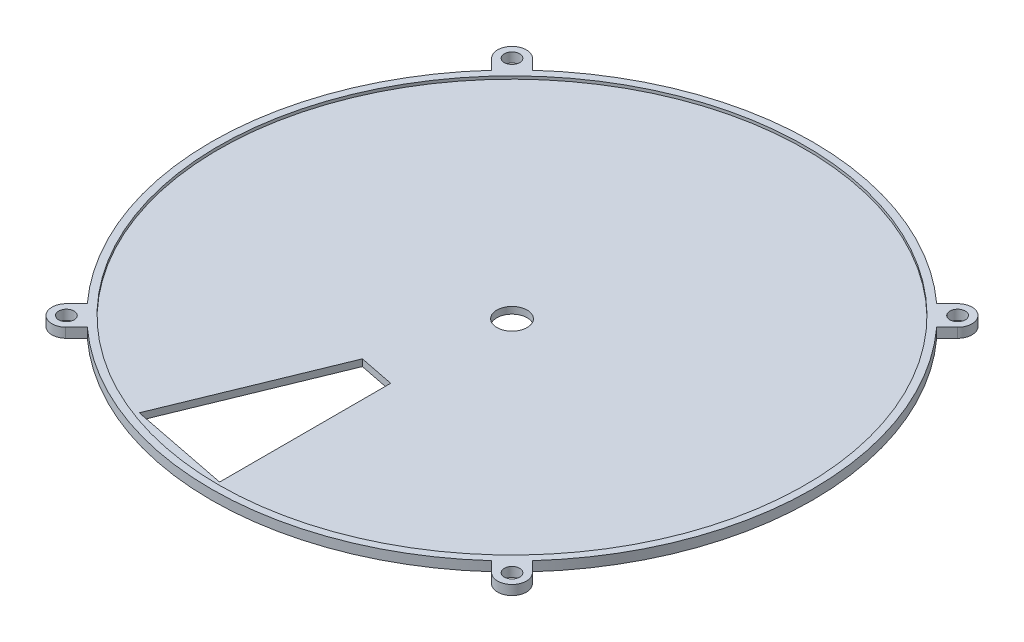
from build123d import *

# Parameters (mm, degrees)
SKETCH_1_R               = 1.6
EXTRUDE_1_DEPTH          = 2
SKETCH_2_R               = 61
CUT_EXTRUDE_3_DEPTH      = 0.6
SKETCH_3_R               = 3.15
CUT_EXTRUDE_4_DEPTH      = 2
CUT_EXTRUDE_6_DEPTH      = 56
CUT_EXTRUDE_6_DEPTH_BACK = 58


with BuildPart() as part:
    # Эскиз1 → Бобышка-Вытянуть1 (new body)
    with BuildSketch(Plane(origin=(0, 0, 0), x_dir=(1, 0, 0), z_dir=(0, 1, 0))):
        with BuildLine():
            ThreePointArc((-44.194173824, 48.436814511), (-48.387717364, 48.484800745), (-48.531650935, 44.293453322))
            Line((-48.531650935, 44.293453322), (-48.337535014, 44.0993374))
            Line((-48.337535014, 44.0993374), (-46.262438284, 42.024240671))
            ThreePointArc((-46.262438284, 42.024240671), (-62.49999998, 0.001572675), (-46.264553121, -42.021912433))
            Line((-46.264553121, -42.021912433), (-48.436814511, -44.194173824))
            ThreePointArc((-48.436814511, -44.194173824), (-48.484800745, -48.387717364), (-44.293453322, -48.531650935))
            Line((-44.293453322, -48.531650935), (-44.0993374, -48.337535014))
            Line((-44.0993374, -48.337535014), (-42.024240671, -46.262438284))
            ThreePointArc((-42.024240671, -46.262438284), (-0.001572675, -62.49999998), (42.021912433, -46.264553121))
            Line((42.021912433, -46.264553121), (44.194173824, -48.436814511))
            ThreePointArc((44.194173824, -48.436814511), (48.387717364, -48.484800745), (48.531650935, -44.293453322))
            Line((48.531650935, -44.293453322), (48.337535014, -44.0993374))
            Line((48.337535014, -44.0993374), (46.262438284, -42.024240671))
            ThreePointArc((46.262438284, -42.024240671), (62.49999998, -0.001572675), (46.264553121, 42.021912433))
            Line((46.264553121, 42.021912433), (48.436814511, 44.194173824))
            ThreePointArc((48.436814511, 44.194173824), (48.484800745, 48.387717364), (44.293453322, 48.531650935))
            Line((44.293453322, 48.531650935), (44.0993374, 48.337535014))
            Line((44.0993374, 48.337535014), (42.024240671, 46.262438284))
            ThreePointArc((42.024240671, 46.262438284), (0.001572675, 62.49999998), (-42.021912433, 46.264553121))
            Line((-42.021912433, 46.264553121), (-44.194173824, 48.436814511))
        make_face()
        with Locations(Location((-46.315494168, -46.315494168, 0), (0, 0, 270))):
            Circle(SKETCH_1_R, mode=Mode.SUBTRACT)
        with Locations(Location((46.315494168, -46.315494168, 0), (0, 0, 270))):
            Circle(SKETCH_1_R, mode=Mode.SUBTRACT)
        with Locations(Location((-46.315494168, 46.315494168, 0), (0, 0, 270))):
            Circle(SKETCH_1_R, mode=Mode.SUBTRACT)
        with Locations(Location((46.315494168, 46.315494168, 0), (0, 0, 270))):
            Circle(SKETCH_1_R, mode=Mode.SUBTRACT)
    extrude(amount=EXTRUDE_1_DEPTH)

    # Эскиз2 → Вырез-Вытянуть3 (cut)
    with BuildSketch(Plane(origin=(0, 2, 0), x_dir=(1, 0, 0), z_dir=(0, 1, 0))):
        with Locations(Location((0, 0, 0), (0, 0, 270))):
            Circle(SKETCH_2_R)
    extrude(amount=-CUT_EXTRUDE_3_DEPTH, mode=Mode.SUBTRACT)

    # Эскиз3 → Вырез-Вытянуть4 (cut)
    with BuildSketch(Plane(origin=(0, 1.4, 0), x_dir=(1, 0, 0), z_dir=(0, 1, 0))):
        with Locations(Location((0, 0, 0), (0, 0, 270))):
            Circle(SKETCH_3_R)
    extrude(amount=-CUT_EXTRUDE_4_DEPTH, mode=Mode.SUBTRACT)

    # Эскиз6 → Вырез-Вытянуть6 (cut, two sides: drawn at the far end of the back side and taken through both)
    with BuildSketch(Plane(origin=(0, 0, 0), x_dir=(1, 0, 0), z_dir=(0, 1, 0)).offset(-CUT_EXTRUDE_6_DEPTH_BACK)):
        Polygon((-21.818311129, -55.668605856), (-8.341675093, -22.760328818), (-1, -24.220678791), (-1, -59.783022844), align=None)
    extrude(amount=CUT_EXTRUDE_6_DEPTH + CUT_EXTRUDE_6_DEPTH_BACK, mode=Mode.SUBTRACT)


solid = part.part
